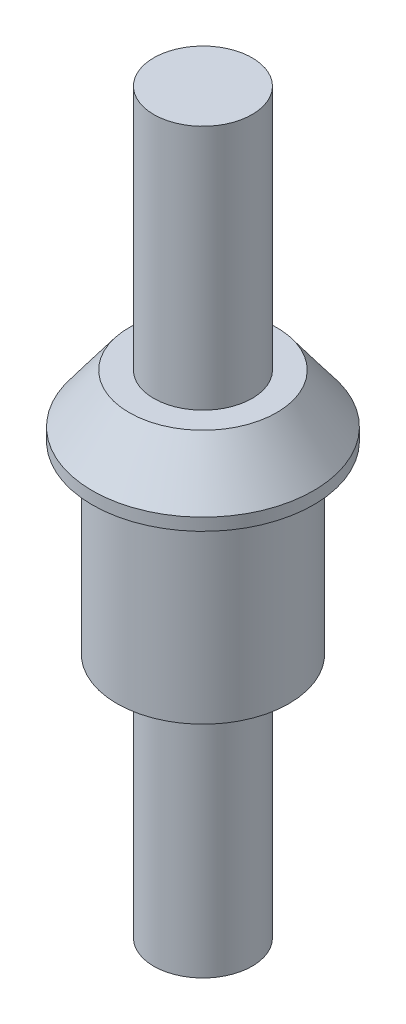
from build123d import *


with BuildPart() as part:
    # Sketch1 → Revolve1 (revolve)
    with BuildSketch(Plane.XY, mode=Mode.PRIVATE) as revolve1_sk:
        Polygon((0, -9.44996569), (0.4, -9.44996569), (0.4, -11.44996569), (0.6, -11.44996569), (0.9, -11.849990339), (0.9, -11.949990339), (0.7, -11.949990339), (0.7, -13.44996569), (0.4, -13.44996569), (0.4, -15.44996569), (0, -15.44996569), align=None)
    revolve(revolve1_sk.sketch.rotate(Axis((0, 28.028089714, 0), (0, -1, 0)), 90), axis=Axis((0, 28.028089714, 0), (0, -1, 0)))


solid = part.part
